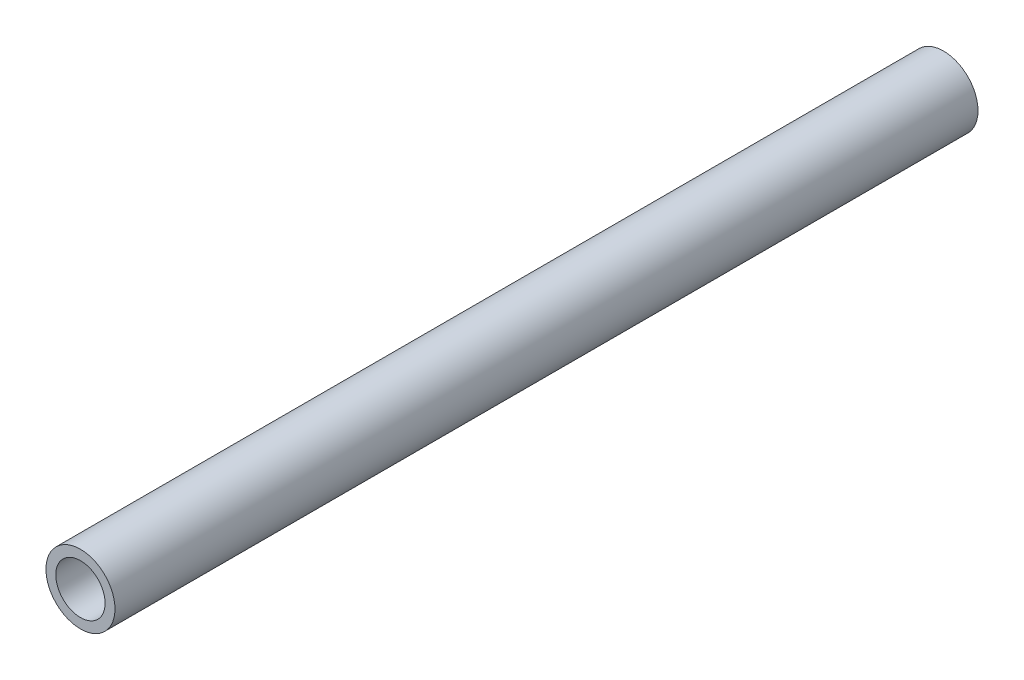
from build123d import *

# Parameters (mm, degrees)
SZKIC1_R                    = 7
SZKIC1_R_2                  = 5
DODANIE_WYCI_GNI_CIE1_DEPTH = 175


with BuildPart() as part:
    # Szkic1 → Dodanie-wyciągnięcie1 (new body)
    with BuildSketch(Plane.XY):
        Circle(SZKIC1_R)
        Circle(SZKIC1_R_2, mode=Mode.SUBTRACT)
    extrude(amount=DODANIE_WYCI_GNI_CIE1_DEPTH)


solid = part.part
